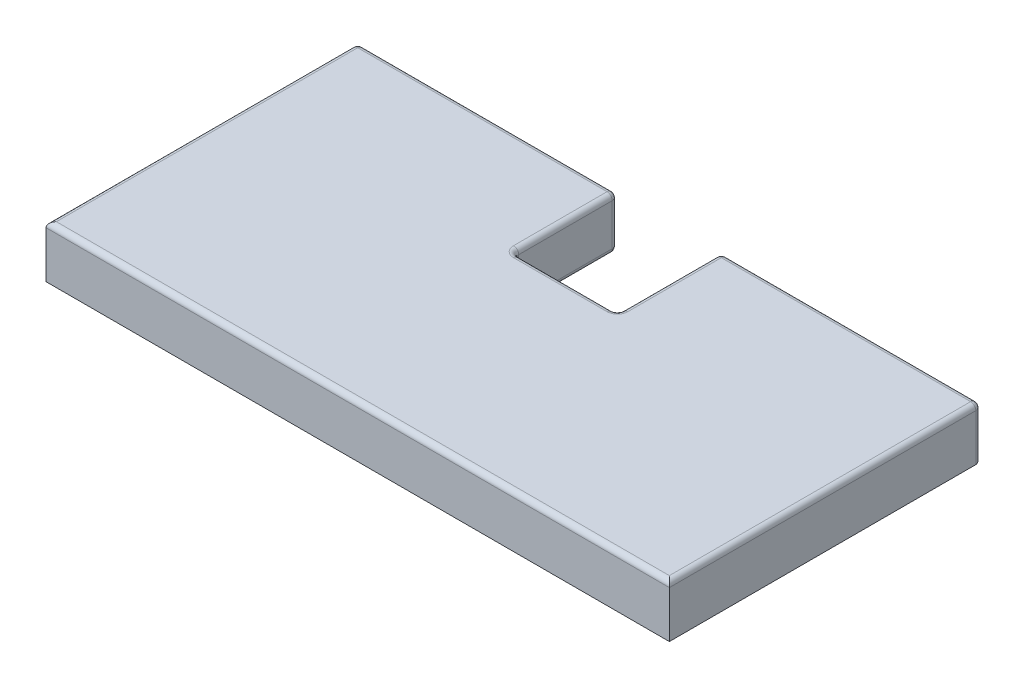
from build123d import *

# Parameters (mm, degrees)
SKETCH1_W           = 60
SKETCH1_H           = 30
BOSS_EXTRUDE1_DEPTH = 5
SKETCH2_W           = 10
SKETCH2_H           = 5
CUT_EXTRUDE1_DEPTH  = 10
FILLET1_R           = 0.5


with BuildPart() as part:
    # Sketch1 → Boss-Extrude1 (new body)
    with BuildSketch(Plane(origin=(0, 0, 0), x_dir=(1, 0, 0), z_dir=(0, 1, 0))):
        with Locations((-486.052613816, 355.540919523)):
            Rectangle(SKETCH1_W, SKETCH1_H)
    extrude(amount=BOSS_EXTRUDE1_DEPTH)

    # Sketch2 → Cut-Extrude1 (cut)
    with BuildSketch(Plane(origin=(0, 0, -370.540919523), x_dir=(-1, 0, 0), z_dir=(0, 0, -1))):
        with Locations((486.052613816, 2.5)):
            Rectangle(SKETCH2_W, SKETCH2_H)
    extrude(amount=-CUT_EXTRUDE1_DEPTH, mode=Mode.SUBTRACT)

    # Fillet1
    fillet1_edges = [part.edges().sort_by_distance(p)[0] for p in [
        (-456.052613816, 5, -355.540919523),
        (-503.552613816, 5, -370.540919523),
        (-468.552613816, 0, -370.540919523),
        (-468.552613816, 5, -370.540919523),
        (-481.052613816, 5, -365.540919523),
        (-491.052613816, 2.5, -370.540919523),
        (-491.052613816, 5, -365.540919523),
        (-486.052613816, 0, -360.540919523),
        (-491.052613816, 0, -365.540919523),
        (-481.052613816, 2.5, -360.540919523),
        (-481.052613816, 0, -365.540919523),
        (-486.052613816, 5, -360.540919523),
        (-491.052613816, 2.5, -360.540919523),
        (-481.052613816, 2.5, -370.540919523),
        (-516.052613816, 5, -355.540919523),
        (-503.552613816, 0, -370.540919523),
        (-486.052613816, 5, -340.540919523),
        (-516.052613816, 2.5, -370.540919523),
        (-456.052613816, 2.5, -370.540919523),
    ]]
    fillet(fillet1_edges, radius=FILLET1_R)


solid = part.part
